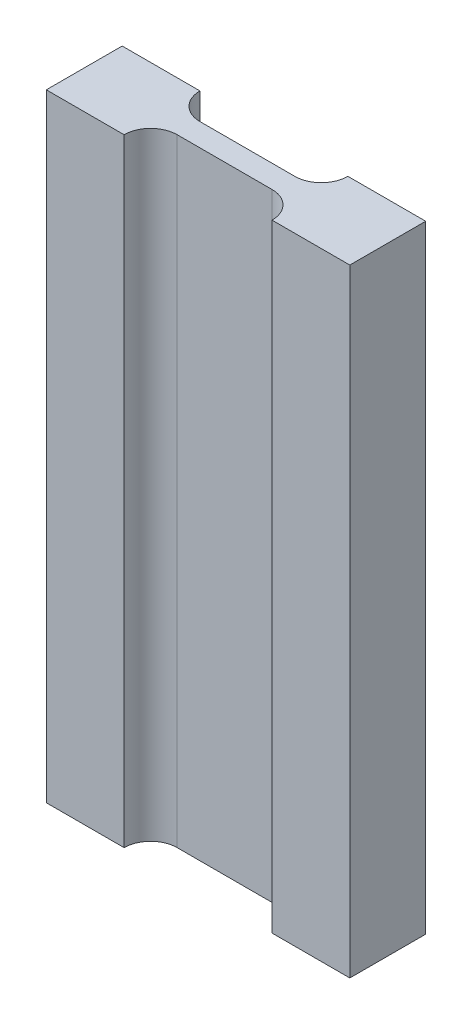
from build123d import *

# Parameters (mm, degrees)
BOSS_EXTRUDE1_DEPTH = 32.55


with BuildPart() as part:
    # Sketch1 → Boss-Extrude1 (new body)
    with BuildSketch(Plane(origin=(0, 0, 0), x_dir=(1, 0, 0), z_dir=(0, 1, 0))):
        with BuildLine():
            Line((0, 0), (4.1, 0))
            ThreePointArc((4.1, 0), (4.510050506, 0.989949494), (5.5, 1.4))
            Line((5.5, 1.4), (10.5, 1.4))
            ThreePointArc((10.5, 1.4), (11.489949494, 0.989949494), (11.9, 0))
            Line((11.9, 0), (16, 0))
            Line((16, 0), (16, 4))
            Line((16, 4), (11.9, 4))
            ThreePointArc((11.9, 4), (11.489949494, 3.010050506), (10.5, 2.6))
            Line((10.5, 2.6), (5.5, 2.6))
            ThreePointArc((5.5, 2.6), (4.510050506, 3.010050506), (4.1, 4))
            Line((4.1, 4), (0, 4))
            Line((0, 4), (0, 0))
        make_face()
    extrude(amount=BOSS_EXTRUDE1_DEPTH)


solid = part.part
